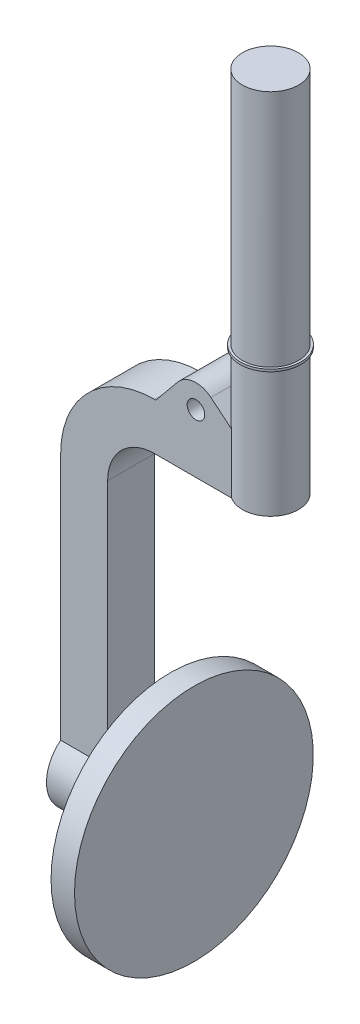
from build123d import *

# Parameters (mm, degrees)
SKETCH1_R           = 9.525
BOSS_EXTRUDE1_DEPTH = 25.4
SKETCH3_R           = 30.353
BOSS_EXTRUDE2_DEPTH = 397.764
SKETCH4_R           = 32.893
BOSS_EXTRUDE3_DEPTH = 2.54


with BuildPart() as part:
    # Sketch1 → Boss-Extrude1 (new, symmetric)
    with BuildSketch(Plane.XY):
        with BuildLine():
            Line((-123.19, -150.1775), (-123.19, 150.1775))
            ThreePointArc((-123.19, 150.1775), (-108.311024484, 186.098524484), (-72.39, 200.9775))
            Line((-72.39, 200.9775), (27.6225, 200.9775))
            Line((27.6225, 200.9775), (27.6225, 251.7775))
            Line((27.6225, 251.7775), (-11.443122974, 284.057790065))
            ThreePointArc((-11.443122974, 284.057790065), (-30.027308672, 289.763403093), (-47.202790065, 280.656877026))
            Line((-47.202790065, 280.656877026), (-71.066089722, 251.7775))
            Line((-71.066089722, 251.7775), (-72.39, 251.7775))
            ThreePointArc((-72.39, 251.7775), (-144.232048969, 222.019548969), (-173.99, 150.1775))
            Line((-173.99, 150.1775), (-173.99, -150.1775))
            Line((-173.99, -150.1775), (-123.19, -150.1775))
        make_face()
        with Locations((-27.6225, 264.4775)):
            Circle(SKETCH1_R, mode=Mode.SUBTRACT)
    extrude(amount=BOSS_EXTRUDE1_DEPTH, both=True)

    # Sketch2 → Revolve1 (revolve)
    with BuildSketch(Plane.XZ.offset(150.1775)):
        Polygon((-173.99, 0), (-123.19, 0), (-55.245, 0), (-55.245, 129.159), (-80.645, 129.159), (-80.645, 25.4), (-123.19, 25.4), (-123.19, 40.719375), (-173.99, 40.719375), align=None)
    revolve(axis=Axis((-173.99, -150.1775, 0), (1, 0, 0)))

    # Sketch3 → Boss-Extrude2 (add)
    with BuildSketch(Plane.XZ.offset(-200.9775)):
        with Locations(Location((27.6225, 0, 0), (0, 0, 236.805836124))):
            Circle(SKETCH3_R)
    extrude(amount=-BOSS_EXTRUDE2_DEPTH)

    # Sketch4 → Boss-Extrude3 (add)
    with BuildSketch(Plane(origin=(0, 340.6775, 0), x_dir=(1, 0, 0), z_dir=(0, 1, 0))):
        with Locations(Location((27.6225, 0, 0), (0, 0, 270))):
            Circle(SKETCH4_R)
    extrude(amount=-BOSS_EXTRUDE3_DEPTH)


solid = part.part
